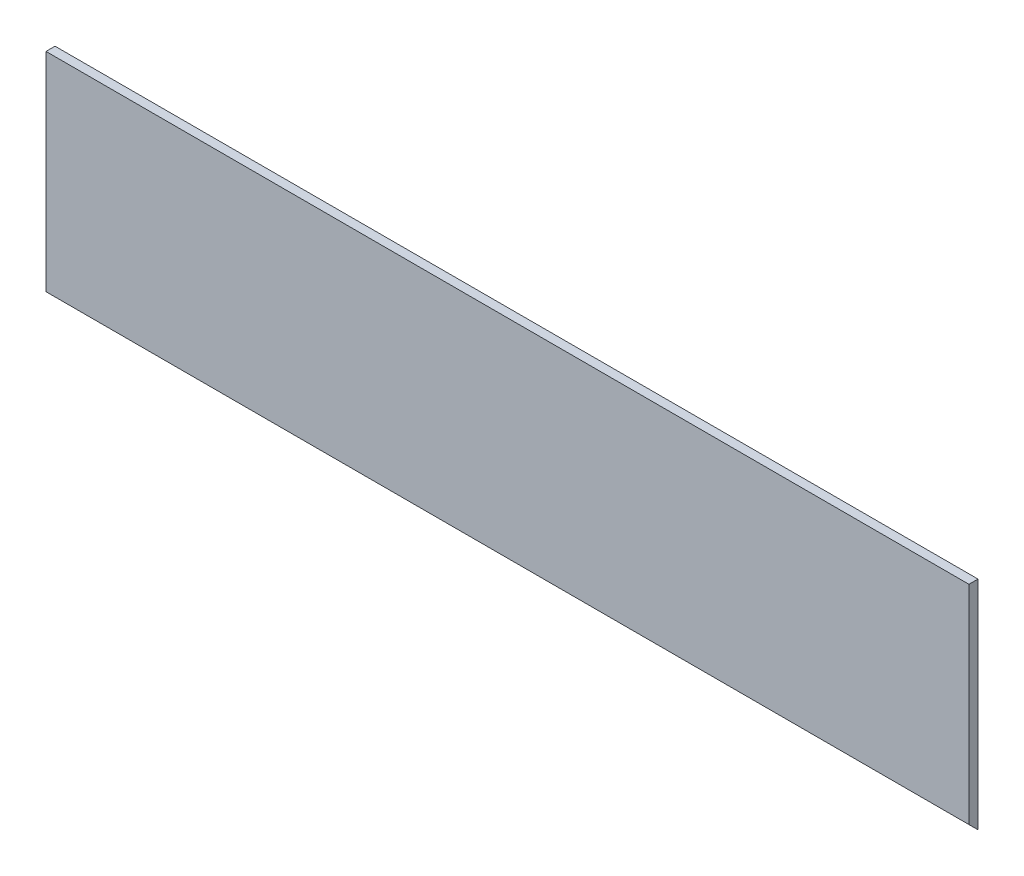
from build123d import *

# Parameters (mm, degrees)
SKETCH_1_W          = 204
SKETCH_1_H          = 48
EXTRUDE_1_DEPTH     = 2
CUT_EXTRUDE_1_DEPTH = 284


with BuildPart() as part:
    # 草图1 → 凸台-拉伸1 (new body)
    with BuildSketch(Plane.XY):
        Rectangle(SKETCH_1_W, SKETCH_1_H)
    extrude(amount=EXTRUDE_1_DEPTH)

    # 草图2 → 切除-拉伸1 (cut)
    with BuildSketch(Plane(origin=(102, 0, 0), x_dir=(0, 0, -1), z_dir=(1, 0, 0))):
        Polygon((0, -24), (-2, -24), (-2, -22), align=None)
    extrude(amount=-CUT_EXTRUDE_1_DEPTH, mode=Mode.SUBTRACT)


solid = part.part
